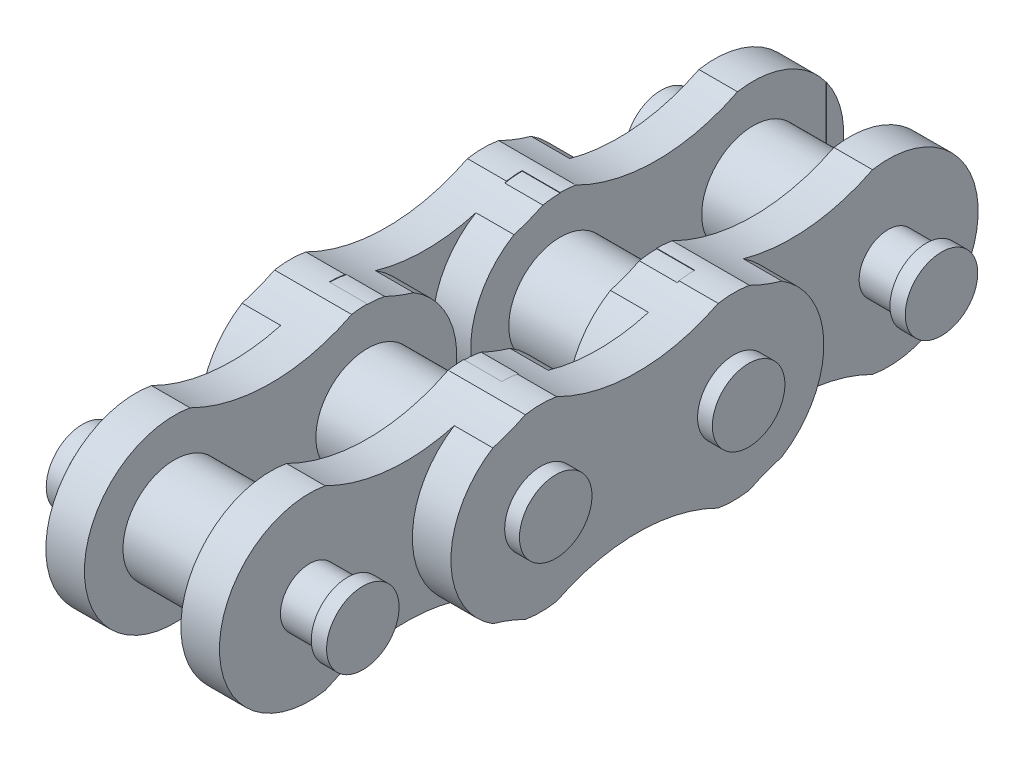
from build123d import *

# Parameters (mm, degrees)
BOSS_EXTRUDE1_DEPTH      = 6.19125
BOSS_EXTRUDE1_DEPTH_BACK = 6.19125
CUT_EXTRUDE1_DEPTH       = 1.905
CUT_EXTRUDE1_DEPTH_BACK  = 1.905
CUT_EXTRUDE2_DEPTH       = 1.905
CUT_EXTRUDE2_DEPTH_BACK  = 1.905
CUT_EXTRUDE3_DEPTH       = 4.26085
CUT_EXTRUDE3_DEPTH_BACK  = 4.26085
CUT_EXTRUDE4_DEPTH       = 2.38125
CUT_EXTRUDE4_DEPTH_BACK  = 2.38125
SKETCH5_W                = 41.063333333
SKETCH5_H                = 17.78
CUT_EXTRUDE5_DEPTH       = 2.35585
CUT_EXTRUDE5_DEPTH_BACK  = 2.35585
SKETCH7_W                = 28.575
SKETCH7_H                = 17.78


with BuildPart() as part:
    # Sketch1 → Boss-Extrude1 (new, two sides: drawn at the far end of the back side and taken through both)
    with BuildSketch(Plane(origin=(0, 0, 0), x_dir=(0, 0, -1), z_dir=(1, 0, 0)).offset(-BOSS_EXTRUDE1_DEPTH_BACK)):
        with BuildLine():
            ThreePointArc((0.77186615, 4.377470462), (-4.445, 0), (0.77186615, -4.377470462))
            ThreePointArc((0.77186615, -4.377470462), (4.7625, -3.431458218), (8.75313385, -4.377470462))
            ThreePointArc((8.75313385, -4.377470462), (9.525, -4.445), (10.29686615, -4.377470462))
            ThreePointArc((10.29686615, -4.377470462), (14.2875, -3.431458218), (18.27813385, -4.377470462))
            ThreePointArc((18.27813385, -4.377470462), (19.05, -4.445), (19.82186615, -4.377470462))
            ThreePointArc((19.82186615, -4.377470462), (23.8125, -3.431458218), (27.80313385, -4.377470462))
            ThreePointArc((27.80313385, -4.377470462), (33.02, 0), (27.80313385, 4.377470462))
            ThreePointArc((27.80313385, 4.377470462), (23.8125, 3.431458218), (19.82186615, 4.377470462))
            ThreePointArc((19.82186615, 4.377470462), (19.05, 4.445), (18.27813385, 4.377470462))
            ThreePointArc((18.27813385, 4.377470462), (14.2875, 3.431458218), (10.29686615, 4.377470462))
            ThreePointArc((10.29686615, 4.377470462), (9.525, 4.445), (8.75313385, 4.377470462))
            ThreePointArc((8.75313385, 4.377470462), (4.7625, 3.431458218), (0.77186615, 4.377470462))
        make_face()
    extrude(amount=BOSS_EXTRUDE1_DEPTH + BOSS_EXTRUDE1_DEPTH_BACK)

    # Sketch2 → Cut-Extrude1 (cut, two sides: drawn at the far end of the back side and taken through both)
    with BuildSketch(Plane(origin=(6.19125, 0, 0), x_dir=(0, 0, -1), z_dir=(1, 0, 0)).offset(-CUT_EXTRUDE1_DEPTH_BACK)):
        with BuildLine():
            Line((-8.89, -4.5466), (9.525, -4.5466))
            Line((9.525, -4.5466), (9.525, -4.445))
            ThreePointArc((9.525, -4.445), (5.08, 0), (9.525, 4.445))
            Line((9.525, 4.445), (9.525, 4.5466))
            Line((9.525, 4.5466), (19.05, 4.5466))
            Line((19.05, 4.5466), (19.05, 4.445))
            ThreePointArc((19.05, 4.445), (23.495, 0), (19.05, -4.445))
            Line((19.05, -4.445), (19.05, -4.5466))
            Line((19.05, -4.5466), (38.1, -4.5466))
            Line((38.1, -4.5466), (38.1, 13.4366))
            Line((38.1, 13.4366), (-8.89, 13.4366))
            Line((-8.89, 13.4366), (-8.89, -4.5466))
        make_face()
    extrude(amount=CUT_EXTRUDE1_DEPTH + CUT_EXTRUDE1_DEPTH_BACK, mode=Mode.SUBTRACT)

    # Sketch3 → Cut-Extrude2 (cut, two sides: drawn at the far end of the back side and taken through both)
    with BuildSketch(Plane.ZY.offset(6.19125).offset(-CUT_EXTRUDE2_DEPTH_BACK)):
        with BuildLine():
            Line((-38.1, -4.5466), (-19.05, -4.5466))
            Line((-19.05, -4.5466), (-19.05, -4.445))
            ThreePointArc((-19.05, -4.445), (-23.495, 0), (-19.05, 4.445))
            Line((-19.05, 4.445), (-19.05, 4.5466))
            Line((-19.05, 4.5466), (-9.525, 4.5466))
            Line((-9.525, 4.5466), (-9.525, 4.445))
            ThreePointArc((-9.525, 4.445), (-5.08, 0), (-9.525, -4.445))
            Line((-9.525, -4.445), (-9.525, -4.5466))
            Line((-9.525, -4.5466), (8.89, -4.5466))
            Line((8.89, -4.5466), (8.89, 13.4366))
            Line((8.89, 13.4366), (-38.1, 13.4366))
            Line((-38.1, 13.4366), (-38.1, -4.5466))
        make_face()
    extrude(amount=CUT_EXTRUDE2_DEPTH + CUT_EXTRUDE2_DEPTH_BACK, mode=Mode.SUBTRACT)

    # Sketch4 → Cut-Extrude3 (cut, two sides: drawn at the far end of the back side and taken through both)
    with BuildSketch(Plane(origin=(0, 0, 0), x_dir=(0, 0, -1), z_dir=(1, 0, 0)).offset(-CUT_EXTRUDE3_DEPTH_BACK)):
        with BuildLine():
            Line((9.525, -4.4958), (19.05, -4.4958))
            Line((19.05, -4.4958), (19.05, -4.4196))
            ThreePointArc((19.05, -4.4196), (14.6304, 0), (19.05, 4.4196))
            Line((19.05, 4.4196), (19.05, 4.4958))
            Line((19.05, 4.4958), (9.525, 4.4958))
            Line((9.525, 4.4958), (9.525, 4.4196))
            ThreePointArc((9.525, 4.4196), (13.9446, 0), (9.525, -4.4196))
            Line((9.525, -4.4196), (9.525, -4.4958))
        make_face()
    extrude(amount=CUT_EXTRUDE3_DEPTH + CUT_EXTRUDE3_DEPTH_BACK, mode=Mode.SUBTRACT)

    # Sketch5 → Cut-Extrude4 (cut, two sides: drawn at the far end of the back side and taken through both)
    with BuildSketch(Plane(origin=(0, 0, 0), x_dir=(0, 0, -1), z_dir=(1, 0, 0)).offset(-CUT_EXTRUDE4_DEPTH_BACK)):
        with Locations((11.641666667, 0)):
            Rectangle(SKETCH5_W, SKETCH5_H)
    extrude(amount=CUT_EXTRUDE4_DEPTH + CUT_EXTRUDE4_DEPTH_BACK, mode=Mode.SUBTRACT)

    # Sketch6 → Revolve1 (revolve)
    with BuildSketch(Plane(origin=(0, 0, 0), x_dir=(1, 0, 0), z_dir=(0, 1, 0))):
        Polygon((-6.9215, 0), (-6.9215, 1.7907), (-6.16585, 1.7907), (-6.16585, 1.43256), (-2.40665, 1.43256), (-2.40665, 2.54), (2.40665, 2.54), (2.40665, 1.43256), (6.16585, 1.43256), (6.16585, 1.7907), (6.9215, 1.7907), (6.9215, 0), align=None)
    revolve(axis=Axis((6.9215, 0, 0), (-1, 0, 0)))

    # Sketch7 → Cut-Extrude5 (cut, two sides: drawn at the far end of the back side and taken through both)
    with BuildSketch(Plane(origin=(0, 0, 0), x_dir=(0, 0, -1), z_dir=(1, 0, 0)).offset(-CUT_EXTRUDE5_DEPTH_BACK)):
        with Locations((33.2105, 0)):
            Rectangle(SKETCH7_W, SKETCH7_H)
    extrude(amount=CUT_EXTRUDE5_DEPTH + CUT_EXTRUDE5_DEPTH_BACK, mode=Mode.SUBTRACT)

    # Sketch8 → Revolve2 (revolve)
    with BuildSketch(Plane(origin=(0, 0, 0), x_dir=(1, 0, 0), z_dir=(0, 1, 0))):
        Polygon((-6.9215, 28.575), (-6.9215, 30.3657), (-6.16585, 30.3657), (-6.16585, 30.00756), (-2.40665, 30.00756), (-2.40665, 31.115), (2.40665, 31.115), (2.40665, 30.00756), (6.16585, 30.00756), (6.16585, 30.3657), (6.9215, 30.3657), (6.9215, 28.575), align=None)
    revolve(axis=Axis((6.9215, 0, -28.575), (-1, 0, 0)))

    # Sketch9 → Revolve3 (revolve)
    with BuildSketch(Plane(origin=(0, 0, 0), x_dir=(1, 0, 0), z_dir=(0, 1, 0))):
        Polygon((-6.9215, 19.05), (-6.9215, 20.8407), (-6.16585, 20.8407), (-6.16585, 20.48256), (-2.40665, 20.48256), (-2.40665, 21.59), (2.40665, 21.59), (2.40665, 20.48256), (6.16585, 20.48256), (6.16585, 20.8407), (6.9215, 20.8407), (6.9215, 19.05), align=None)
    revolve(axis=Axis((6.9215, 0, -19.05), (-1, 0, 0)))

    # Sketch10 → Revolve4 (revolve)
    with BuildSketch(Plane(origin=(0, 0, 0), x_dir=(1, 0, 0), z_dir=(0, 1, 0))):
        Polygon((-6.9215, 9.525), (-6.9215, 11.3157), (-6.16585, 11.3157), (-6.16585, 10.95756), (-2.40665, 10.95756), (-2.40665, 12.065), (2.40665, 12.065), (2.40665, 10.95756), (6.16585, 10.95756), (6.16585, 11.3157), (6.9215, 11.3157), (6.9215, 9.525), align=None)
    revolve(axis=Axis((6.9215, 0, -9.525), (-1, 0, 0)))


solid = part.part
